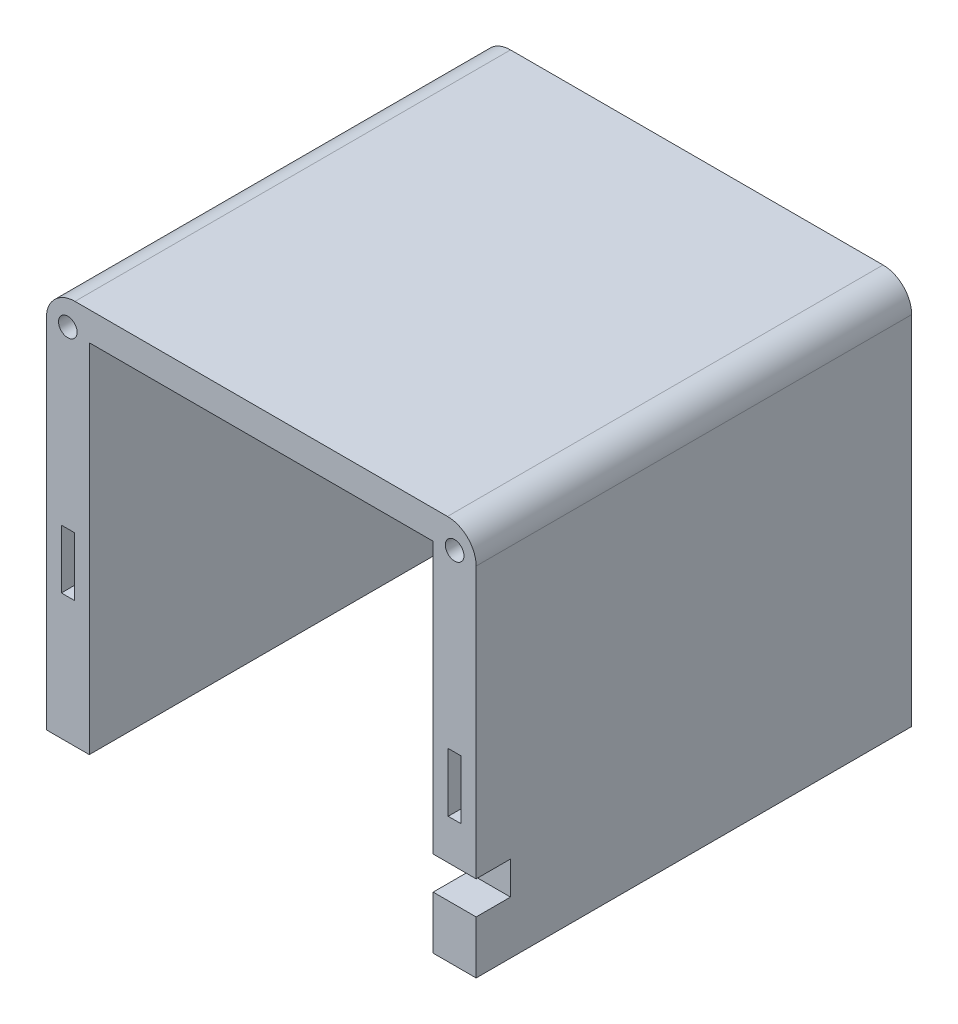
from build123d import *

# Parameters (mm, degrees)
SKETCH2_W           = 120
SKETCH2_H           = 114.5
BOSS_EXTRUDE1_DEPTH = 152
SKETCH3_R           = 3.25
CUT_EXTRUDE1_DEPTH  = 27.5
SKETCH4_W           = 120
SKETCH4_H           = 10.090135052
CUT_EXTRUDE2_DEPTH  = 192.859758942
SKETCH5_W           = 9.929816524
SKETCH5_H           = 99.5
SKETCH5_W_2         = 106.146314573
SKETCH5_H_2         = 4.565432885
SKETCH5_W_3         = 9.245001591
CUT_EXTRUDE3_DEPTH  = 140
SKETCH6_W           = 5
SKETCH6_H           = 99.5
BOSS_EXTRUDE2_DEPTH = 10
SKETCH7_W           = 106.146314573
SKETCH7_H           = 5
BOSS_EXTRUDE3_DEPTH = 6
SKETCH8_W           = 5
SKETCH8_H           = 99.5
BOSS_EXTRUDE4_DEPTH = 10
SKETCH9_R           = 3.25
CUT_EXTRUDE4_DEPTH  = 5
SKETCH11_W          = 12
SKETCH11_H          = 11.501568892
CUT_EXTRUDE5_DEPTH  = 35
SKETCH12_W          = 6.942410631
SKETCH12_H          = 9.961568892
BOSS_EXTRUDE5_DEPTH = 9.5
SKETCH13_W          = 4.5
SKETCH13_H          = 20.5
CUT_EXTRUDE6_DEPTH  = 15


with BuildPart() as part:
    # Sketch2 → Boss-Extrude1 (new body)
    with BuildSketch(Plane.XY):
        with BuildLine():
            Line((-48.742911668, 61.163031625), (81.257088332, 61.163031625))
            ThreePointArc((81.257088332, 61.163031625), (88.328156143, 58.234099437), (91.257088332, 51.163031625))
            Line((91.257088332, 51.163031625), (91.257088332, -73.336968375))
            Line((91.257088332, -73.336968375), (-58.742911668, -73.336968375))
            Line((-58.742911668, -73.336968375), (-58.742911668, 51.163031625))
            ThreePointArc((-58.742911668, 51.163031625), (-55.81397948, 58.234099437), (-48.742911668, 61.163031625))
        make_face()
        with Locations((16.257088332, -6.086968375)):
            Rectangle(SKETCH2_W, SKETCH2_H, mode=Mode.SUBTRACT)
    extrude(amount=BOSS_EXTRUDE1_DEPTH)

    # Sketch3 → Cut-Extrude1 (cut)
    with BuildSketch(Plane.XY.offset(152)):
        with Locations((-51.242911668, 52.163031625)):
            Circle(SKETCH3_R)
        with Locations((83.757088332, 52.163031625)):
            Circle(SKETCH3_R)
    extrude(amount=-CUT_EXTRUDE1_DEPTH, mode=Mode.SUBTRACT)

    # Sketch4 → Cut-Extrude2 (cut, through all)
    with BuildSketch(Plane.XY.offset(152)):
        with Locations((16.257088332, -68.382035901)):
            Rectangle(SKETCH4_W, SKETCH4_H)
    extrude(amount=-CUT_EXTRUDE2_DEPTH, mode=Mode.SUBTRACT)

    # Sketch5 → Cut-Extrude3 (cut)
    with BuildSketch(Plane.XY.offset(152)):
        with Locations((-51.653725831, -3.586968375)):
            Rectangle(SKETCH5_W, SKETCH5_H)
        with Locations((16.314156243, 56.459462148)):
            Rectangle(SKETCH5_W_2, SKETCH5_H_2)
        with Locations((83.825495028, -3.586968375)):
            Rectangle(SKETCH5_W_3, SKETCH5_H)
    extrude(amount=-CUT_EXTRUDE3_DEPTH, mode=Mode.SUBTRACT)

    # Sketch6 → Boss-Extrude2 (add)
    with BuildSketch(Plane.ZY.offset(46.688817569)):
        with Locations((149.5, -3.586968375)):
            Rectangle(SKETCH6_W, SKETCH6_H)
    extrude(amount=BOSS_EXTRUDE2_DEPTH)

    # Sketch7 → Boss-Extrude3 (add)
    with BuildSketch(Plane(origin=(0, 54.176745705, 0), x_dir=(1, 0, 0), z_dir=(0, 1, 0))):
        with Locations((16.314156243, -149.5)):
            Rectangle(SKETCH7_W, SKETCH7_H)
    extrude(amount=BOSS_EXTRUDE3_DEPTH)

    # Sketch8 → Boss-Extrude4 (add)
    with BuildSketch(Plane(origin=(79.202994232, 0, 0), x_dir=(0, 0, -1), z_dir=(1, 0, 0))):
        with Locations((-149.5, -3.586968375)):
            Rectangle(SKETCH8_W, SKETCH8_H)
    extrude(amount=BOSS_EXTRUDE4_DEPTH)

    # Sketch9 → Cut-Extrude4 (cut)
    with BuildSketch(Plane(origin=(0, 0, 0), x_dir=(-1, 0, 0), z_dir=(0, 0, -1))):
        with Locations((-83.757088332, 56.163031625)):
            Circle(SKETCH9_R)
        with Locations((-83.757088332, -3.836968375)):
            Circle(SKETCH9_R)
        with Locations((51.242911668, -3.836968375)):
            Circle(SKETCH9_R)
        with Locations((51.242911668, 56.163031625)):
            Circle(SKETCH9_R)
    extrude(amount=-CUT_EXTRUDE4_DEPTH, mode=Mode.SUBTRACT)

    # Sketch11 → Cut-Extrude5 (cut)
    with BuildSketch(Plane(origin=(91.257088332, 0, 0), x_dir=(0, 0, -1), z_dir=(1, 0, 0))):
        with Locations((-146, -49.126183929)):
            Rectangle(SKETCH11_W, SKETCH11_H)
    extrude(amount=-CUT_EXTRUDE5_DEPTH, mode=Mode.SUBTRACT)

    # Sketch12 → Boss-Extrude5 (add)
    with BuildSketch(Plane(origin=(79.202994232, 0, 0), x_dir=(0, 0, -1), z_dir=(1, 0, 0))):
        with Locations((-136.528794684, -48.356183929)):
            Rectangle(SKETCH12_W, SKETCH12_H)
    extrude(amount=BOSS_EXTRUDE5_DEPTH)

    # Sketch13 → Cut-Extrude6 (cut)
    with BuildSketch(Plane.XY.offset(152)):
        with Locations((83.757088332, -19.086968375)):
            Rectangle(SKETCH13_W, SKETCH13_H)
        with Locations((-51.242911668, -19.086968375)):
            Rectangle(SKETCH13_W, SKETCH13_H)
    extrude(amount=-CUT_EXTRUDE6_DEPTH, mode=Mode.SUBTRACT)


solid = part.part
